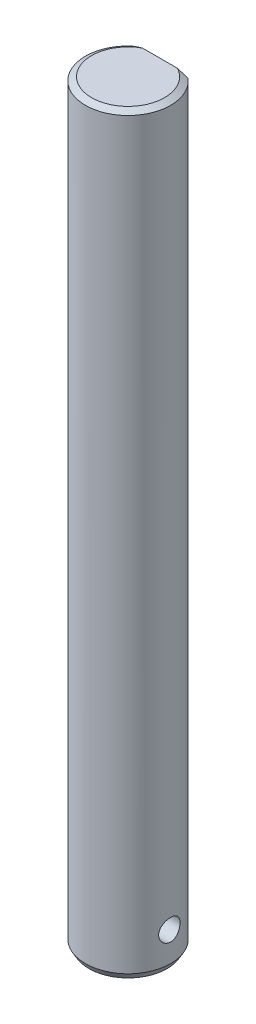
from build123d import *
from OCP.BRepFilletAPI import BRepFilletAPI_MakeChamfer

# Parameters (mm, degrees)
SKETCH1_R           = 6
BOSS_EXTRUDE1_DEPTH = 106
SKETCH2_W           = 19.454800155
SKETCH2_H           = 6.800936495
CUT_EXTRUDE1_DEPTH  = 10
SKETCH3_R           = 1.5
CUT_EXTRUDE2_DEPTH  = 20
CHAMFER1_SIZE       = 0.5
CHAMFER1_SIZE2      = 0.866025404


with BuildPart() as part:
    # Sketch1 → Boss-Extrude1 (new body)
    with BuildSketch(Plane(origin=(0, 0, 0), x_dir=(1, 0, 0), z_dir=(0, 1, 0))):
        with Locations(Location((0, 0, 0), (0, 0, 270))):
            Circle(SKETCH1_R)
    extrude(amount=BOSS_EXTRUDE1_DEPTH)

    # Sketch2 → Cut-Extrude1 (cut)
    with BuildSketch(Plane(origin=(0, 106, 0), x_dir=(1, 0, 0), z_dir=(0, 1, 0))):
        with Locations((0.164871187, 7.900468248)):
            Rectangle(SKETCH2_W, SKETCH2_H)
    extrude(amount=-CUT_EXTRUDE1_DEPTH, mode=Mode.SUBTRACT)

    # Sketch3 → Cut-Extrude2 (cut, symmetric)
    with BuildSketch(Plane(origin=(0, 0, 0), x_dir=(0, 0, -1), z_dir=(1, 0, 0))):
        with Locations((0, 5)):
            Circle(SKETCH3_R)
    extrude(amount=CUT_EXTRUDE2_DEPTH, both=True, mode=Mode.SUBTRACT)

    # Chamfer1: one chamfer whose edges measure the first distance from different faces: ONE call of the kernel's chamfer builder (chamfer() names one face for all edges)
    chamfer1_edges_1 = [part.edges().sort_by_distance(p)[0] for p in [
        (0, 0, -6),
    ]]
    chamfer1_side_1 = [part.faces().sort_by_distance(p)[0] for p in [
        (0, 0, 0),
    ]]
    chamfer1_edges_2 = [part.edges().sort_by_distance(p)[0] for p in [
        (5.61248608, 106, 2.121320344),
    ]]
    chamfer1_side_2 = [part.faces().sort_by_distance(p)[0] for p in [
        (0, 53, -6),
    ]]
    chamfer1 = BRepFilletAPI_MakeChamfer(part.part.solid().wrapped)
    for e in chamfer1_edges_1:
        chamfer1.Add(CHAMFER1_SIZE, CHAMFER1_SIZE2, e.wrapped, chamfer1_side_1[0].wrapped)  # the first distance lies on this face
    for e in chamfer1_edges_2:
        chamfer1.Add(CHAMFER1_SIZE, CHAMFER1_SIZE2, e.wrapped, chamfer1_side_2[0].wrapped)  # the first distance lies on this face
    add(Compound.cast(chamfer1.Shape()), mode=Mode.REPLACE)


solid = part.part
